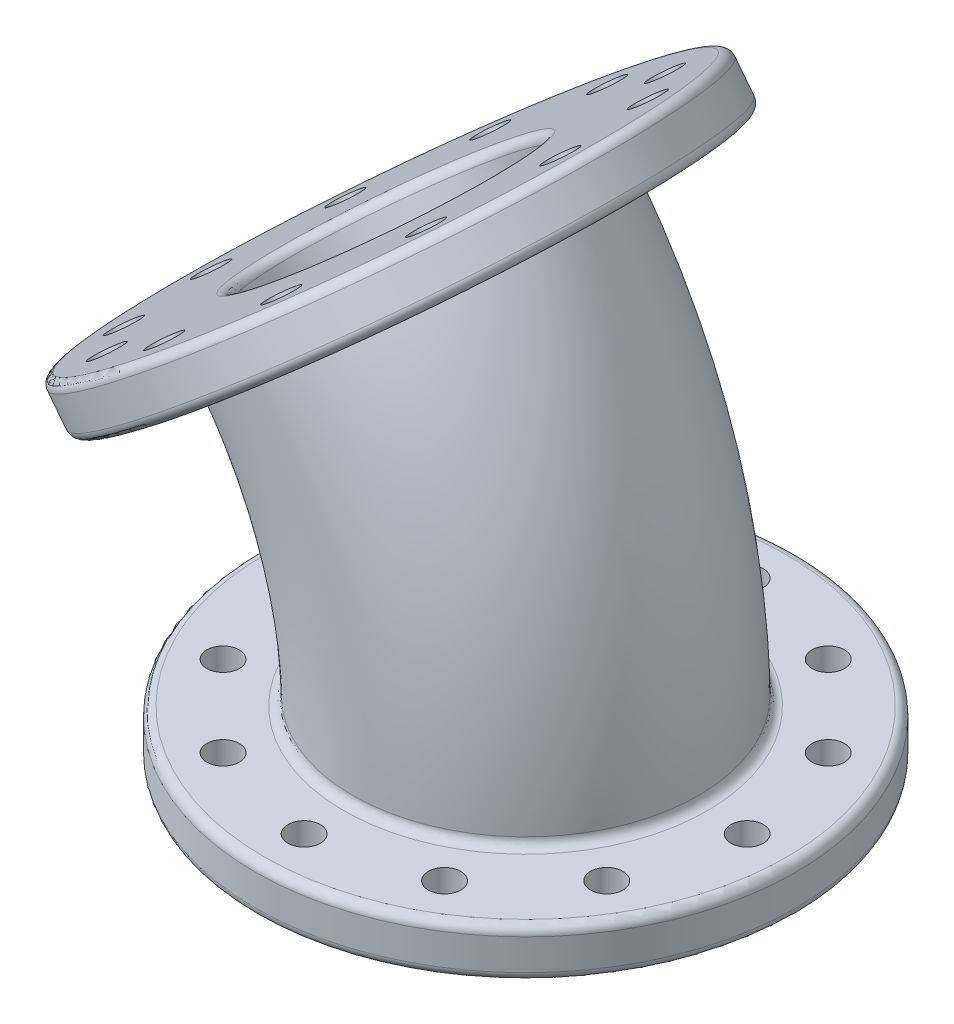
from build123d import *

# Parameters (mm, degrees)
SKETCH1_R           = 61
SKETCH1_R_2         = 28
SKETCH1_R_3         = 3.665
BOSS_EXTRUDE1_DEPTH = 11
SKETCH2_R           = 39
SKETCH2_R_2         = 28
REVOLVE1_ANGLE      = 38
SKETCH3_R           = 61
SKETCH3_R_2         = 28
SKETCH3_R_3         = 3.666666667
BOSS_EXTRUDE2_DEPTH = 11
FILLET1_R           = 2


with BuildPart() as part:
    # Sketch1 → Boss-Extrude1 (new body)
    with BuildSketch(Plane(origin=(0, 0, 0), x_dir=(1, 0, 0), z_dir=(0, 1, 0))):
        with Locations(Location((0, 0, 0), (0, 0, 270))):
            Circle(SKETCH1_R)
        with Locations(Location((0, 0, 0), (0, 0, 270))):
            Circle(SKETCH1_R_2, mode=Mode.SUBTRACT)
        with Locations(Location((0, 50, 0), (0, 0, 270))):
            Circle(SKETCH1_R_3, mode=Mode.SUBTRACT)
        with Locations(Location((25, 43.301270189, 0), (0, 0, 270))):
            Circle(SKETCH1_R_3, mode=Mode.SUBTRACT)
        with Locations(Location((43.301270189, 25, 0), (0, 0, 270))):
            Circle(SKETCH1_R_3, mode=Mode.SUBTRACT)
        with Locations(Location((50, 0, 0), (0, 0, 270))):
            Circle(SKETCH1_R_3, mode=Mode.SUBTRACT)
        with Locations(Location((43.301270189, -25, 0), (0, 0, 270))):
            Circle(SKETCH1_R_3, mode=Mode.SUBTRACT)
        with Locations(Location((25, -43.301270189, 0), (0, 0, 270))):
            Circle(SKETCH1_R_3, mode=Mode.SUBTRACT)
        with Locations(Location((0, -50, 0), (0, 0, 270))):
            Circle(SKETCH1_R_3, mode=Mode.SUBTRACT)
        with Locations(Location((-25, -43.301270189, 0), (0, 0, 270))):
            Circle(SKETCH1_R_3, mode=Mode.SUBTRACT)
        with Locations(Location((-43.301270189, -25, 0), (0, 0, 270))):
            Circle(SKETCH1_R_3, mode=Mode.SUBTRACT)
        with Locations(Location((-50, 0, 0), (0, 0, 270))):
            Circle(SKETCH1_R_3, mode=Mode.SUBTRACT)
        with Locations(Location((-43.301270189, 25, 0), (0, 0, 270))):
            Circle(SKETCH1_R_3, mode=Mode.SUBTRACT)
        with Locations(Location((-25, 43.301270189, 0), (0, 0, 270))):
            Circle(SKETCH1_R_3, mode=Mode.SUBTRACT)
    extrude(amount=BOSS_EXTRUDE1_DEPTH)

    # Sketch2 → Revolve1 (revolve)
    with BuildSketch(Plane(origin=(0, 11, 0), x_dir=(1, 0, 0), z_dir=(0, 1, 0))):
        Circle(SKETCH2_R)
        Circle(SKETCH2_R_2, mode=Mode.SUBTRACT)
    revolve(axis=Axis((-117, 11, -31.377943925), (0, 0, 1)), revolution_arc=REVOLVE1_ANGLE)

    # Sketch3 → Boss-Extrude2 (add)
    with BuildSketch(Plane(origin=(-49.684195602, 63.592870413, 0), x_dir=(0.7880107536067209, 0.6156614753256596, 0), z_dir=(-0.6156614753256596, 0.7880107536067209, 0))):
        with Locations(Location((31.575018057, 0, 0), (0, 0, 180))):
            Circle(SKETCH3_R)
        with Locations((31.575018057, 0)):
            Circle(SKETCH3_R_2, mode=Mode.SUBTRACT)
        with Locations(Location((31.575018057, 50, 0), (0, 0, 180))):
            Circle(SKETCH3_R_3, mode=Mode.SUBTRACT)
        with Locations(Location((56.575018057, 43.301270189, 0), (0, 0, 180))):
            Circle(SKETCH3_R_3, mode=Mode.SUBTRACT)
        with Locations(Location((74.876288246, 25, 0), (0, 0, 180))):
            Circle(SKETCH3_R_3, mode=Mode.SUBTRACT)
        with Locations(Location((81.575018057, 0, 0), (0, 0, 180))):
            Circle(SKETCH3_R_3, mode=Mode.SUBTRACT)
        with Locations(Location((74.876288246, -25, 0), (0, 0, 180))):
            Circle(SKETCH3_R_3, mode=Mode.SUBTRACT)
        with Locations(Location((56.575018057, -43.301270189, 0), (0, 0, 180))):
            Circle(SKETCH3_R_3, mode=Mode.SUBTRACT)
        with Locations(Location((31.575018057, -50, 0), (0, 0, 180))):
            Circle(SKETCH3_R_3, mode=Mode.SUBTRACT)
        with Locations(Location((6.575018057, -43.301270189, 0), (0, 0, 180))):
            Circle(SKETCH3_R_3, mode=Mode.SUBTRACT)
        with Locations(Location((-11.726252133, -25, 0), (0, 0, 180))):
            Circle(SKETCH3_R_3, mode=Mode.SUBTRACT)
        with Locations(Location((-18.424981943, 0, 0), (0, 0, 180))):
            Circle(SKETCH3_R_3, mode=Mode.SUBTRACT)
        with Locations(Location((-11.726252133, 25, 0), (0, 0, 180))):
            Circle(SKETCH3_R_3, mode=Mode.SUBTRACT)
        with Locations(Location((6.575018057, 43.301270189, 0), (0, 0, 180))):
            Circle(SKETCH3_R_3, mode=Mode.SUBTRACT)
    extrude(amount=BOSS_EXTRUDE2_DEPTH)

    # Fillet1
    fillet1_edges = [part.edges().sort_by_distance(p)[0] for p in [
        (0, 0, -61),
        (0, 11, -61),
        (0, 0, -28),
        (-39, 11, 0),
        (-55.535161219, 59.021595075, 0),
        (16.493637913, 129.255860898, 0),
        (23.265914142, 120.587742608, 0),
        (-53.639319158, 74.461989594, 0),
    ]]
    fillet(fillet1_edges, radius=FILLET1_R)


solid = part.part
